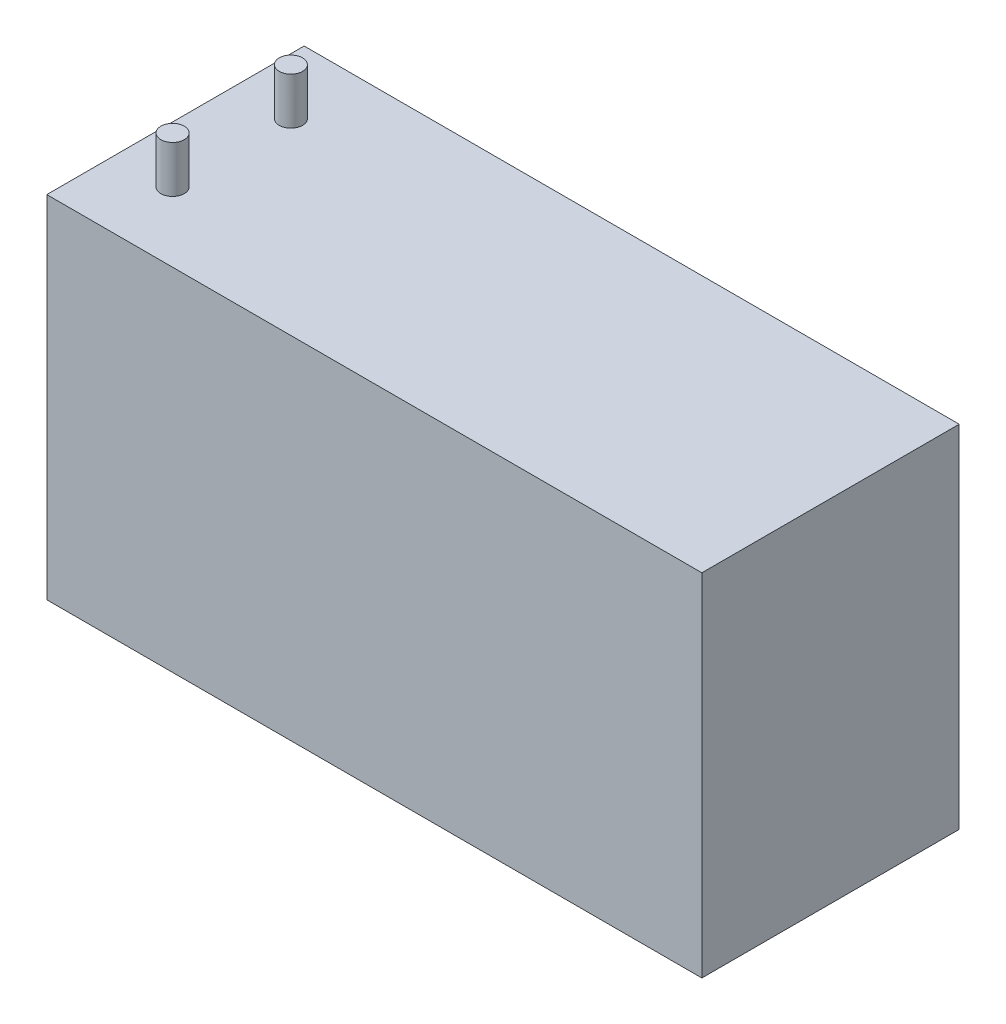
from build123d import *

# Parameters (mm, degrees)
SKETCH_1_W      = 28
SKETCH_1_H      = 15
EXTRUDE_1_DEPTH = 11
SKETCH_2_R      = 0.5
EXTRUDE_2_DEPTH = 2


with BuildPart() as part:
    # 草图1 → 凸台-拉伸1 (new body)
    with BuildSketch(Plane.XY):
        Rectangle(SKETCH_1_W, SKETCH_1_H)
    extrude(amount=EXTRUDE_1_DEPTH)

    # 草图2 → 凸台-拉伸2 (add)
    with BuildSketch(Plane(origin=(0, 7.5, 0), x_dir=(1, 0, 0), z_dir=(0, 1, 0))):
        with Locations(Location((-11.594640153, -2.971812887, 0), (0, 0, 90))):
            Circle(SKETCH_2_R)
        with Locations(Location((-11.594640153, -8.028187113, 0), (0, 0, 90))):
            Circle(SKETCH_2_R)
    extrude(amount=EXTRUDE_2_DEPTH)


solid = part.part
